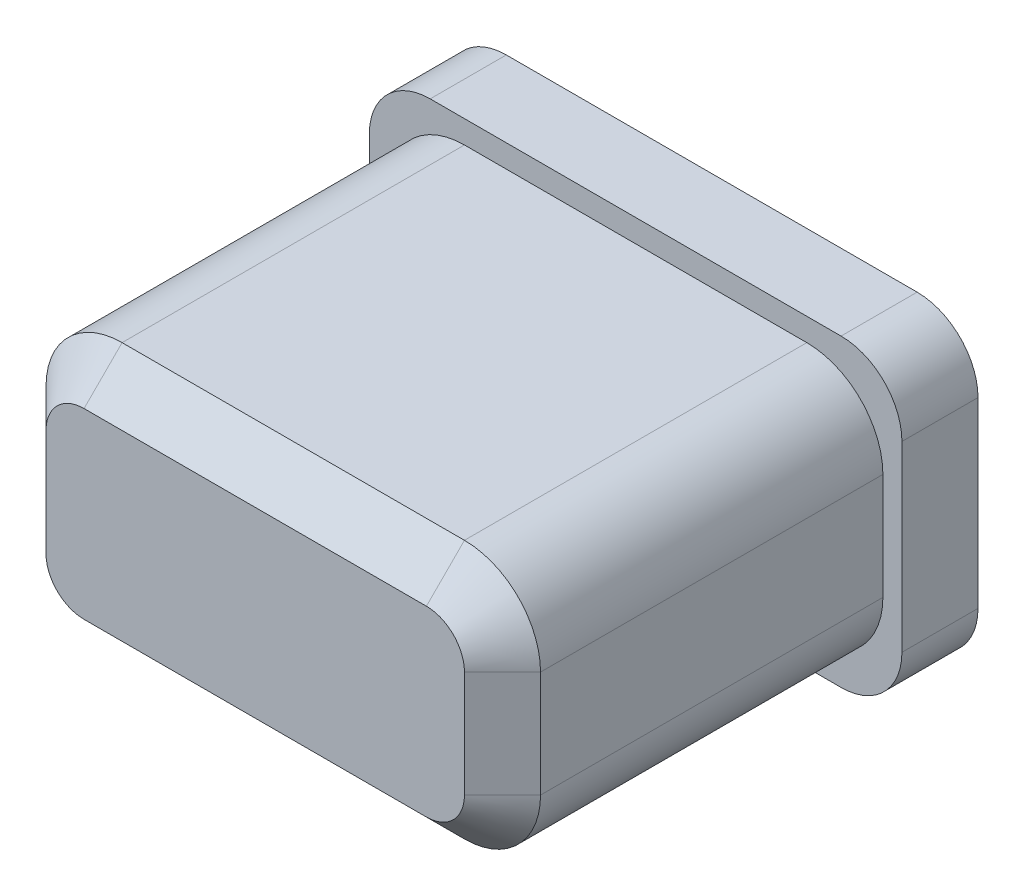
from build123d import *

# Parameters (mm, degrees)
SKETCH_1_W      = 6.5
SKETCH_1_H      = 3.4
EXTRUDE_1_DEPTH = 5
FILLET_1_R      = 1
CHAMFER_1_SIZE  = 0.5
SKETCH_2_W      = 7
SKETCH_2_H      = 4
EXTRUDE_2_DEPTH = 1
FILLET_2_R      = 0.8


with BuildPart() as part:
    # 草图1 → 凸台-拉伸1 (new body)
    with BuildSketch(Plane.XY):
        Rectangle(SKETCH_1_W, SKETCH_1_H)
    extrude(amount=EXTRUDE_1_DEPTH)

    # 圆角1
    fillet_1_edges = [part.edges().sort_by_distance(p)[0] for p in [
        (3.25, -1.7, 2.5),
        (-3.25, -1.7, 2.5),
        (-3.25, 1.7, 2.5),
        (3.25, 1.7, 2.5),
    ]]
    fillet(fillet_1_edges, radius=FILLET_1_R)

    # 倒角1
    chamfer_1_edges = [part.edges().sort_by_distance(p)[0] for p in [
        (-3.25, 0, 5),
        (0, 1.7, 5),
        (3.25, 0, 5),
        (0, -1.7, 5),
        (-2.957106781, -1.407106781, 5),
        (2.957106781, -1.407106781, 5),
        (2.957106781, 1.407106781, 5),
        (-2.957106781, 1.407106781, 5),
    ]]
    chamfer(chamfer_1_edges, length=CHAMFER_1_SIZE)

    # 草图2 → 凸台-拉伸2 (add)
    with BuildSketch(Plane(origin=(0, 0, 0), x_dir=(-1, 0, 0), z_dir=(0, 0, -1))):
        Rectangle(SKETCH_2_W, SKETCH_2_H)
    extrude(amount=EXTRUDE_2_DEPTH)

    # 圆角2
    fillet_2_edges = [part.edges().sort_by_distance(p)[0] for p in [
        (3.5, 2, -0.5),
        (3.5, -2, -0.5),
        (-3.5, -2, -0.5),
        (-3.5, 2, -0.5),
    ]]
    fillet(fillet_2_edges, radius=FILLET_2_R)


solid = part.part
